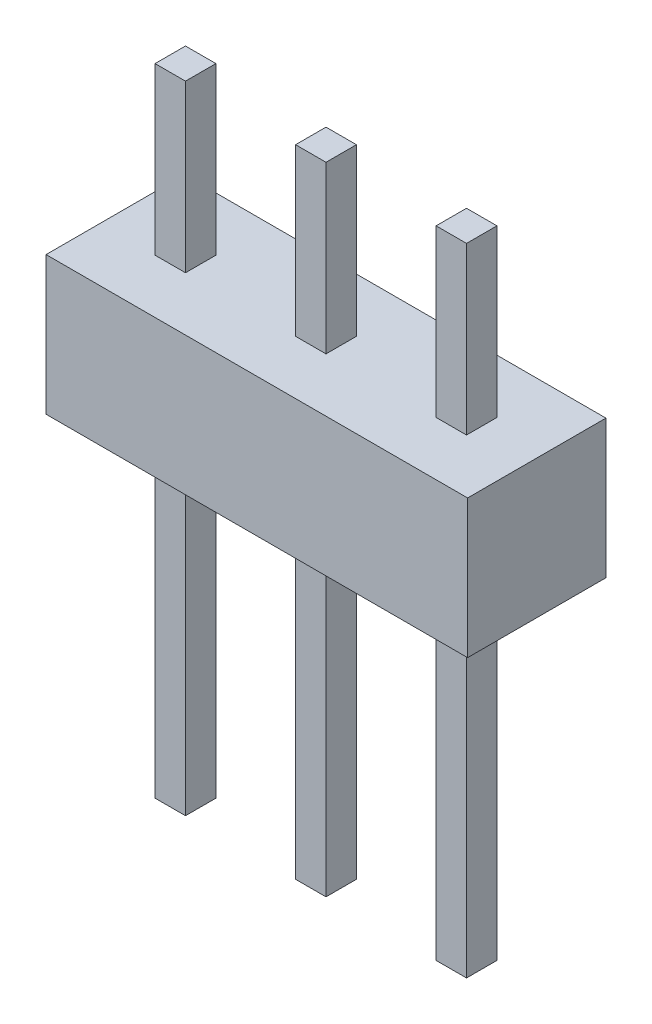
from build123d import *

# Parameters (mm, degrees)
SKETCH1_W             = 7.62
SKETCH1_H             = 2.5
BOSS_EXTRUDE1_DEPTH   = 1.25
SKETCH2_W             = 0.55
SKETCH2_H             = 0.55
BOSS_EXTRUDE2_DEPTH   = 6
BOSS_EXTRUDE2_2_DEPTH = 6
BOSS_EXTRUDE2_3_DEPTH = 6
SKETCH2_2_W           = 0.55
SKETCH2_2_H           = 0.55
BOSS_EXTRUDE3_DEPTH   = 5.5
BOSS_EXTRUDE3_2_DEPTH = 5.5
BOSS_EXTRUDE3_3_DEPTH = 5.5


with BuildPart() as part:
    # Sketch1 → Boss-Extrude1 (new, symmetric)
    with BuildSketch(Plane.XY):
        with Locations((3.81, 1.25)):
            Rectangle(SKETCH1_W, SKETCH1_H)
    extrude(amount=BOSS_EXTRUDE1_DEPTH, both=True)


with BuildPart() as body_2:
    # Sketch2 → Boss-Extrude2 (new body)
    with BuildSketch(Plane.XZ):
        with Locations((3.81, 0)):
            Rectangle(SKETCH2_W, SKETCH2_H)
    extrude(amount=BOSS_EXTRUDE2_DEPTH)


with BuildPart() as body_3:
    # Sketch2 → Boss-Extrude2 2 (new body)
    with BuildSketch(Plane.XZ):
        with Locations((1.27, 0)):
            Rectangle(SKETCH2_W, SKETCH2_H)
    extrude(amount=BOSS_EXTRUDE2_2_DEPTH)


with BuildPart() as body_4:
    # Sketch2 → Boss-Extrude2 3 (new body)
    with BuildSketch(Plane.XZ):
        with Locations((6.35, 0)):
            Rectangle(SKETCH2_W, SKETCH2_H)
    extrude(amount=BOSS_EXTRUDE2_3_DEPTH)


with BuildPart() as body_5:
    # Sketch2<2> → Boss-Extrude3 (new body)
    with BuildSketch(Plane.XZ):
        with Locations((3.81, 0)):
            Rectangle(SKETCH2_2_W, SKETCH2_2_H)
    extrude(amount=-BOSS_EXTRUDE3_DEPTH)


with BuildPart() as body_6:
    # Sketch2<2> → Boss-Extrude3 2 (new body)
    with BuildSketch(Plane.XZ):
        with Locations((1.27, 0)):
            Rectangle(SKETCH2_2_W, SKETCH2_2_H)
    extrude(amount=-BOSS_EXTRUDE3_2_DEPTH)


with BuildPart() as body_7:
    # Sketch2<2> → Boss-Extrude3 3 (new body)
    with BuildSketch(Plane.XZ):
        with Locations((6.35, 0)):
            Rectangle(SKETCH2_2_W, SKETCH2_2_H)
    extrude(amount=-BOSS_EXTRUDE3_3_DEPTH)


solid = Compound([part.part, body_2.part, body_3.part, body_4.part, body_5.part, body_6.part, body_7.part])
